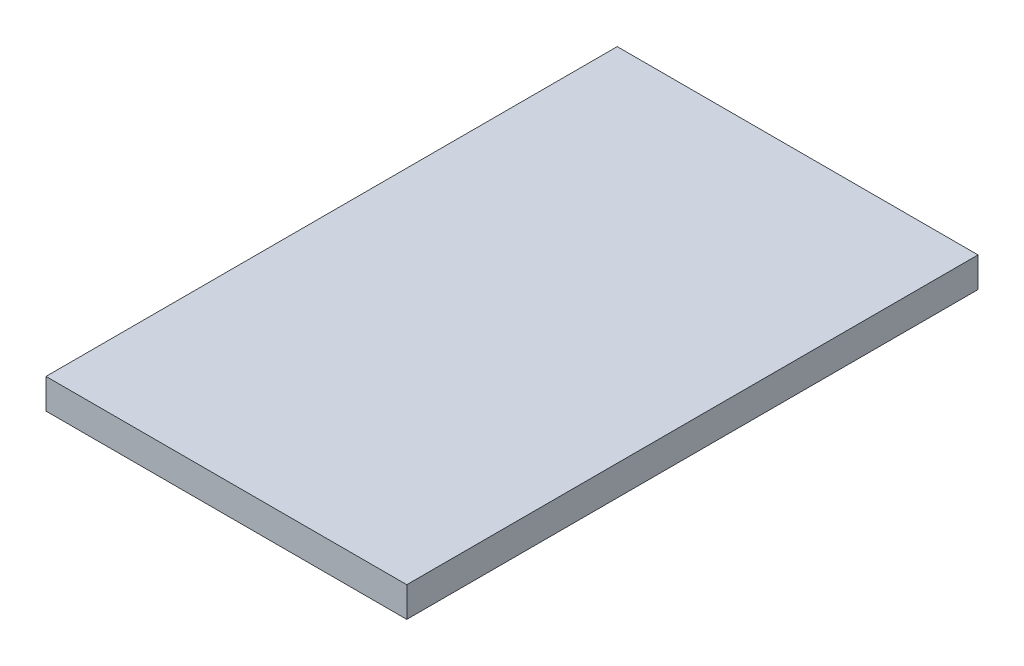
from build123d import *

# Parameters (mm, degrees)
SKETCH_1_W      = 12
SKETCH_1_H      = 19
EXTRUDE_1_DEPTH = 1


with BuildPart() as part:
    # 草图1 → 凸台-拉伸1 (new body)
    with BuildSketch(Plane(origin=(0, 0, 0), x_dir=(1, 0, 0), z_dir=(0, 1, 0))):
        with Locations((6, 9.5)):
            Rectangle(SKETCH_1_W, SKETCH_1_H)
    extrude(amount=EXTRUDE_1_DEPTH)


solid = part.part
